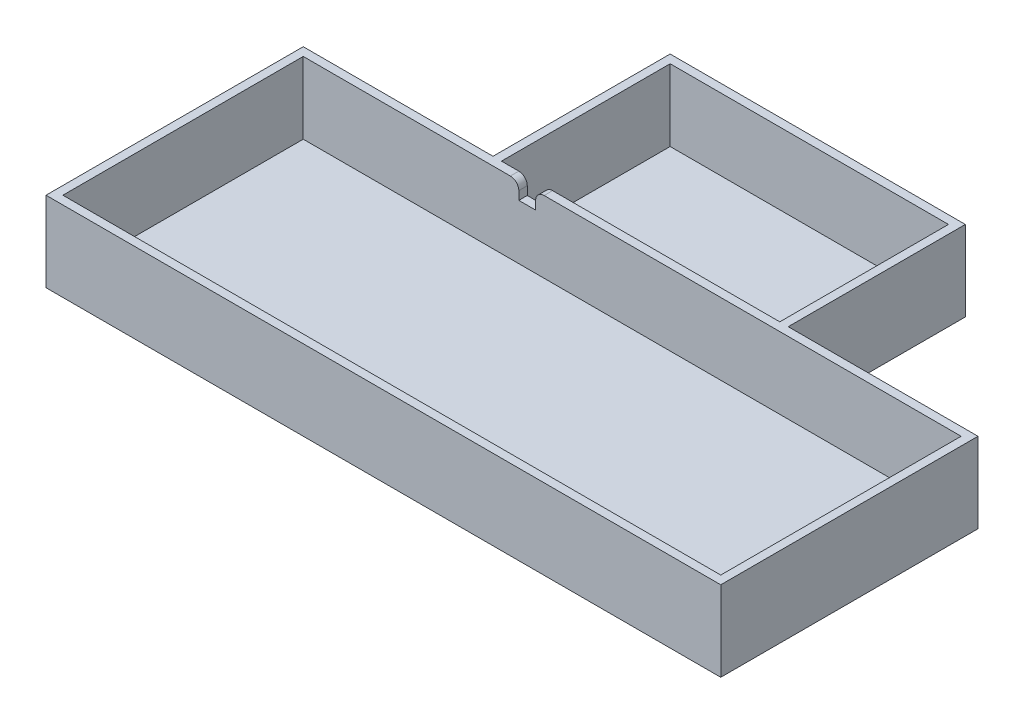
from build123d import *

# Parameters (mm, degrees)
SKETCH1_W           = 160
SKETCH1_H           = 61
BOSS_EXTRUDE1_DEPTH = 2
SKETCH2_W           = 160
SKETCH2_H           = 2
BOSS_EXTRUDE2_DEPTH = 17
SKETCH3_W           = 156
SKETCH3_H           = 2
BOSS_EXTRUDE3_DEPTH = 17
SKETCH4_W           = 70
SKETCH4_H           = 2
BOSS_EXTRUDE4_DEPTH = 42
SKETCH5_W           = 4
SKETCH5_H           = 8
CUT_EXTRUDE1_DEPTH  = 39
FILLET1_R           = 2
SKETCH6_W           = 2
SKETCH6_H           = 42
BOSS_EXTRUDE5_DEPTH = 17
SKETCH9_W           = 66
SKETCH9_H           = 2
BOSS_EXTRUDE6_DEPTH = 17


with BuildPart() as part:
    # Sketch1 → Boss-Extrude1 (new body)
    with BuildSketch(Plane(origin=(0, 0, 0), x_dir=(1, 0, 0), z_dir=(0, 1, 0))):
        with Locations((80, -30.5)):
            Rectangle(SKETCH1_W, SKETCH1_H)
    extrude(amount=BOSS_EXTRUDE1_DEPTH)

    # Sketch2 → Boss-Extrude2 (add)
    with BuildSketch(Plane(origin=(0, 2, 0), x_dir=(1, 0, 0), z_dir=(0, 1, 0))):
        with Locations((80, -1)):
            Rectangle(SKETCH2_W, SKETCH2_H)
    extrude(amount=BOSS_EXTRUDE2_DEPTH)

    # Sketch3 → Boss-Extrude3 (add)
    with BuildSketch(Plane(origin=(0, 2, 0), x_dir=(1, 0, 0), z_dir=(0, 1, 0))):
        Polygon((0, -2), (0, -61), (2, -61), (2, -59), (2, -2), align=None)
        Polygon((158, -59), (158, -61), (160, -61), (160, -2), (158, -2), align=None)
        with Locations((80, -60)):
            Rectangle(SKETCH3_W, SKETCH3_H)
    extrude(amount=BOSS_EXTRUDE3_DEPTH)

    # Sketch4 → Boss-Extrude4 (add)
    with BuildSketch(Plane(origin=(0, 0, 0), x_dir=(-1, 0, 0), z_dir=(0, 0, -1))):
        with Locations((-80, 1)):
            Rectangle(SKETCH4_W, SKETCH4_H)
    extrude(amount=BOSS_EXTRUDE4_DEPTH)

    # Sketch5 → Cut-Extrude1 (cut)
    with BuildSketch(Plane(origin=(0, 0, 0), x_dir=(-1, 0, 0), z_dir=(0, 0, -1))):
        with Locations((-55.116937283, 19)):
            Rectangle(SKETCH5_W, SKETCH5_H)
    extrude(amount=-CUT_EXTRUDE1_DEPTH, mode=Mode.SUBTRACT)

    # Fillet1
    fillet1_edges = [part.edges().sort_by_distance(p)[0] for p in [
        (53.116937283, 19, 1),
        (57.116937283, 19, 1),
    ]]
    fillet(fillet1_edges, radius=FILLET1_R)

    # Sketch6 → Boss-Extrude5 (add)
    with BuildSketch(Plane(origin=(0, 2, 0), x_dir=(1, 0, 0), z_dir=(0, 1, 0))):
        with Locations((114, 21)):
            Rectangle(SKETCH6_W, SKETCH6_H)
    extrude(amount=BOSS_EXTRUDE5_DEPTH)

    # Sketch9 → Boss-Extrude6 (add)
    with BuildSketch(Plane(origin=(0, 2, 0), x_dir=(1, 0, 0), z_dir=(0, 1, 0))):
        Polygon((47, 42), (45, 42), (45, 0), (47, 0), (47, 40), align=None)
        with Locations((80, 41)):
            Rectangle(SKETCH9_W, SKETCH9_H)
    extrude(amount=BOSS_EXTRUDE6_DEPTH)


solid = part.part
